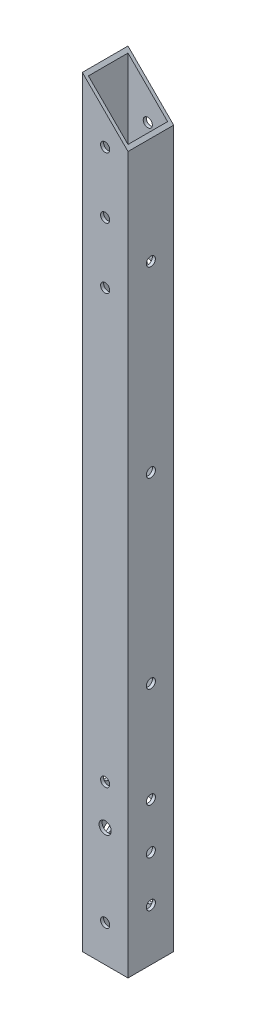
from build123d import *

# Parameters (mm, degrees)
SKETCH_1_W          = 15
SKETCH_1_H          = 15
SKETCH_1_W_2        = 13
SKETCH_1_H_2        = 13
EXTRUDE_1_DEPTH     = 250
SKETCH_2_R          = 1.5
SKETCH_2_R_2        = 2
CUT_EXTRUDE_1_DEPTH = 251.561868607
SKETCH_3_R          = 1.5
CUT_EXTRUDE_2_DEPTH = 251.561868607


with BuildPart() as part:
    # 草图1 → 凸台-拉伸1 (new body)
    with BuildSketch(Plane(origin=(0, 0, 0), x_dir=(1, 0, 0), z_dir=(0, 1, 0))):
        Rectangle(SKETCH_1_W, SKETCH_1_H)
        Rectangle(SKETCH_1_W_2, SKETCH_1_H_2, mode=Mode.SUBTRACT)
    extrude(amount=EXTRUDE_1_DEPTH)

    # 草图2 → 切除-拉伸1 (cut, through all)
    with BuildSketch(Plane.XY.offset(7.5)):
        with Locations((0, 232.5)):
            Circle(SKETCH_2_R)
        with Locations((0, 212.5)):
            Circle(SKETCH_2_R)
        with Locations((0, 192.5)):
            Circle(SKETCH_2_R)
        with Locations((0, 12)):
            Circle(SKETCH_2_R)
        with Locations((0, 39)):
            Circle(SKETCH_2_R_2)
        with Locations((0, 52)):
            Circle(SKETCH_2_R)
        Polygon((7.5, 250), (7.5, 235), (-7.5, 250), align=None)
    extrude(amount=-CUT_EXTRUDE_1_DEPTH, mode=Mode.SUBTRACT)

    # 草图3 → 切除-拉伸2 (cut, through all)
    with BuildSketch(Plane(origin=(7.5, 0, 0), x_dir=(0, 0, -1), z_dir=(1, 0, 0))):
        with Locations((0, 17)):
            Circle(SKETCH_3_R)
        with Locations((0, 32)):
            Circle(SKETCH_3_R)
        with Locations((0, 47)):
            Circle(SKETCH_3_R)
        with Locations((0, 80)):
            Circle(SKETCH_3_R)
        with Locations((0, 140)):
            Circle(SKETCH_3_R)
        with Locations((0, 200)):
            Circle(SKETCH_3_R)
    extrude(amount=-CUT_EXTRUDE_2_DEPTH, mode=Mode.SUBTRACT)


solid = part.part
